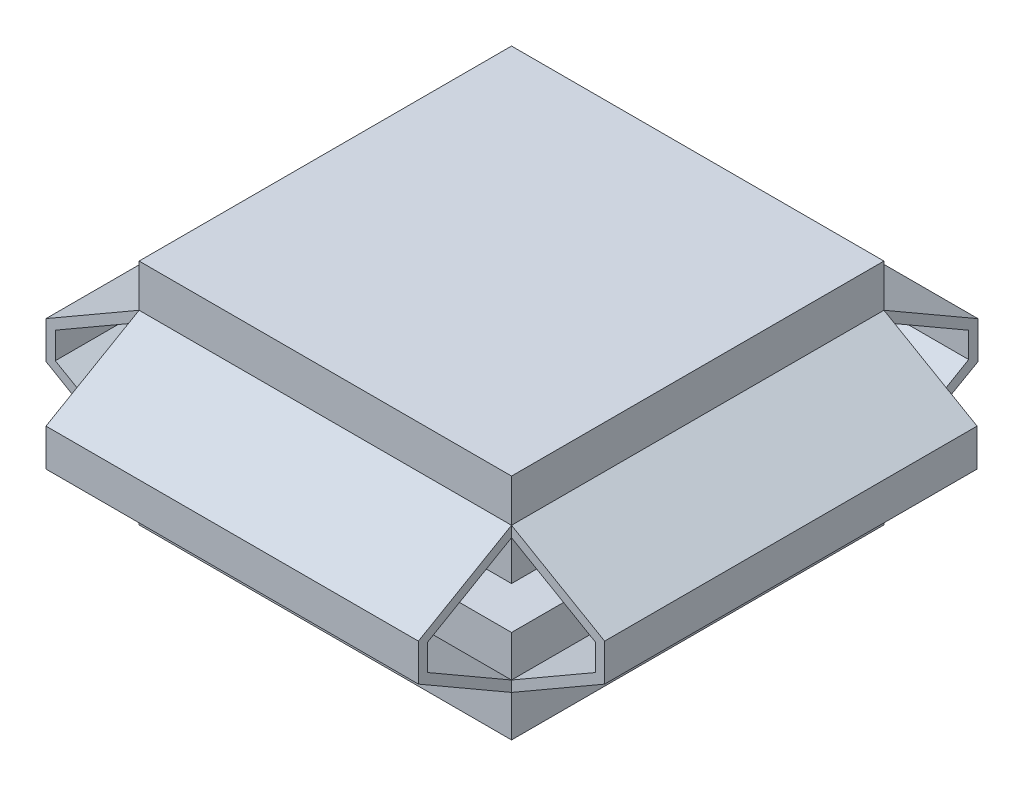
from build123d import *

# Parameters (mm, degrees)
SKETCH1_W           = 20
SKETCH1_H           = 20
BOSS_EXTRUDE1_DEPTH = 5
BOSS_EXTRUDE2_DEPTH = 20
BOSS_EXTRUDE4_DEPTH = 20
BOSS_EXTRUDE6_DEPTH = 20


with BuildPart() as part:
    # Sketch1 → Boss-Extrude1 (new body)
    with BuildSketch(Plane(origin=(0, 0, 0), x_dir=(1, 0, 0), z_dir=(0, 1, 0))):
        Rectangle(SKETCH1_W, SKETCH1_H)
    boss_extrude1 = extrude(amount=BOSS_EXTRUDE1_DEPTH)

    # Sketch2 → Boss-Extrude2 (add)
    with BuildSketch(Plane.XY.offset(10)):
        Polygon((10, 2.211324865), (15, 5.098076211), (15, 7.098076211), (10, 9.984827557), (10, 9.407477288), (14.5, 6.809401077), (14.5, 5.386751346), (10, 2.788675135), align=None)
    boss_extrude2 = extrude(amount=-BOSS_EXTRUDE2_DEPTH)

    # Mirror1: Boss-Extrude2 across plane
    add(boss_extrude2.mirror(Plane(origin=(0, 0, 0), x_dir=(0, 0, 1), z_dir=(1, 0, 0))))

    # Mirror2: Boss-Extrude1 across plane
    add(boss_extrude1.mirror(Plane.ZX.offset(6.137)))


with BuildPart() as body_2:
    # Sketch7 → Boss-Extrude4 (new body)
    with BuildSketch(Plane(origin=(10, 0, 0), x_dir=(0, 0, -1), z_dir=(1, 0, 0))):
        Polygon((-10, 2.211324865), (-10, 2.788675135), (-14.5, 5.386751346), (-14.5, 6.809401077), (-10, 9.407477288), (-10, 9.984827557), (-15, 7.098076211), (-15, 5.098076211), align=None)
    extrude(amount=-BOSS_EXTRUDE4_DEPTH)


with BuildPart() as body_3:
    # Sketch8 → Boss-Extrude6 (new body)
    with BuildSketch(Plane(origin=(10, 0, 0), x_dir=(0, 0, -1), z_dir=(1, 0, 0))):
        Polygon((10, 2.211324865), (10, 2.788675135), (14.550639741, 5.415988214), (14.550639741, 6.780164209), (10, 9.407477288), (10, 9.984827557), (15.050639741, 7.068839343), (15.050639741, 5.068839343), align=None)
    extrude(amount=-BOSS_EXTRUDE6_DEPTH)


solid = Compound([part.part, body_2.part, body_3.part])
